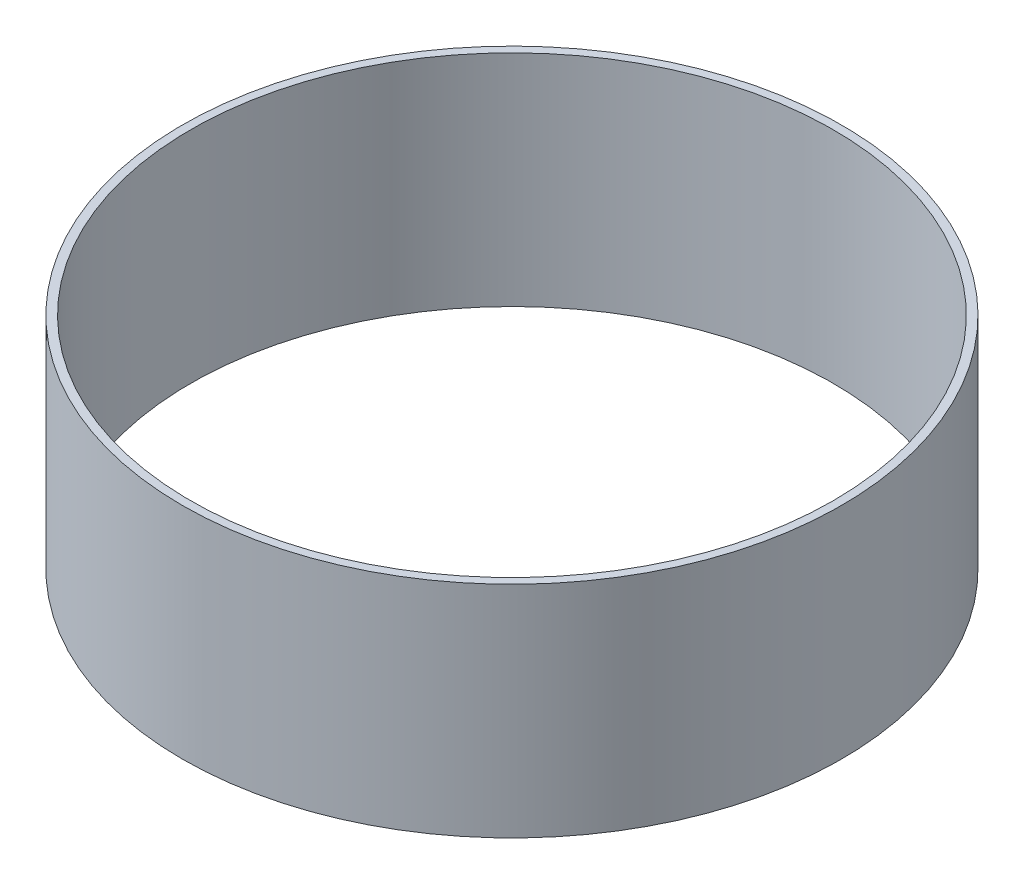
from build123d import *

# Parameters (mm, degrees)
SCHIZZO1_R                = 60
SCHIZZO1_R_2              = 58.5
ESTRUSIONE_SOTTILE1_DEPTH = 20


with BuildPart() as part:
    # Schizzo1 → Estrusione-Sottile1 (new, symmetric)
    with BuildSketch(Plane(origin=(0, 0, 0), x_dir=(1, 0, 0), z_dir=(0, 1, 0))):
        Circle(SCHIZZO1_R)
        Circle(SCHIZZO1_R_2, mode=Mode.SUBTRACT)
    extrude(amount=ESTRUSIONE_SOTTILE1_DEPTH, both=True)


solid = part.part
